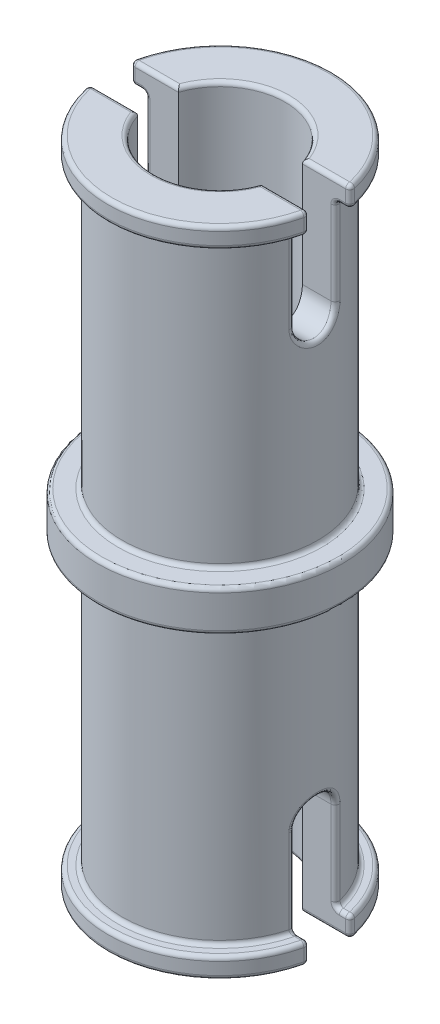
from build123d import *

# Parameters (mm, degrees)
CUT_EXTRUDE1_DEPTH      = 7.5
CUT_EXTRUDE2_DEPTH      = 10
CUT_EXTRUDE2_DEPTH_BACK = 10
FILLET3_R               = 0.8
FILLET4_R               = 0.1
SKETCH4_R               = 12.687072168
CUT_EXTRUDE3_DEPTH      = 10


with BuildPart() as part:
    # Sketch1 → Revolve1 (revolve)
    with BuildSketch(Plane(origin=(0, 0, 0), x_dir=(0, 0, -1), z_dir=(1, 0, 0))):
        Polygon((2.4, 0.5), (2.4, 7.5), (3, 7.5), (3, 8.5), (2.4, 8.5), (2.4, 16), (0, 16), (0, 7.5), (1.6, 7.5), (1.6, 0), (2.75, 0), (2.75, 0.5), align=None)
    revolve(axis=Axis((0, 0, 0), (0, 1, 0)))

    # Sketch2 → Cut-Extrude1 (cut)
    with BuildSketch(Plane(origin=(0, 16, 0), x_dir=(1, 0, 0), z_dir=(0, 1, 0))):
        with BuildLine():
            Line((0.9, -0.9), (2.224859546, -0.9))
            ThreePointArc((2.224859546, -0.9), (1.697056275, -1.697056275), (0.9, -2.224859546))
            Line((0.9, -2.224859546), (0.9, -0.9))
        make_face()
        with BuildLine():
            Line((-0.9, -0.9), (-0.9, -2.224859546))
            ThreePointArc((-0.9, -2.224859546), (-1.697056275, -1.697056275), (-2.224859546, -0.9))
            Line((-2.224859546, -0.9), (-0.9, -0.9))
        make_face()
        with BuildLine():
            Line((-0.9, 2.224859546), (-0.9, 0.9))
            Line((-0.9, 0.9), (-2.224859546, 0.9))
            ThreePointArc((-2.224859546, 0.9), (-1.697056275, 1.697056275), (-0.9, 2.224859546))
        make_face()
        with BuildLine():
            Line((0.9, 2.224859546), (0.9, 0.9))
            Line((0.9, 0.9), (2.224859546, 0.9))
            ThreePointArc((2.224859546, 0.9), (1.697056275, 1.697056275), (0.9, 2.224859546))
        make_face()
    extrude(amount=-CUT_EXTRUDE1_DEPTH, mode=Mode.SUBTRACT)

    # Sketch3 → Cut-Extrude2 (cut, two sides: drawn at the far end of the back side and taken through both)
    with BuildSketch(Plane(origin=(0, 0, 0), x_dir=(0, 0, -1), z_dir=(1, 0, 0)).offset(-CUT_EXTRUDE2_DEPTH_BACK)):
        with BuildLine():
            Line((0.5, 2.657804805), (0.5, 0))
            Line((0.5, 0), (-0.5, 0))
            Line((-0.5, 0), (-0.5, 2.657804805))
            ThreePointArc((-0.5, 2.657804805), (0, 3.157804805), (0.5, 2.657804805))
        make_face()
    extrude(amount=CUT_EXTRUDE2_DEPTH + CUT_EXTRUDE2_DEPTH_BACK, mode=Mode.SUBTRACT)

    # Fillet3
    fillet3_edges = [part.edges().sort_by_distance(p)[0] for p in [
        (2.4, 16, 0),
        (0.9, 16, -1.562429773),
        (1.562429773, 16, -0.9),
        (0, 16, -2.4),
        (-1.562429773, 16, -0.9),
        (-0.9, 16, -1.562429773),
        (0, 16, 2.4),
        (1.562429773, 16, 0.9),
        (0.9, 16, 1.562429773),
        (-2.4, 16, 0),
        (-0.9, 16, 1.562429773),
        (-1.562429773, 16, 0.9),
    ]]
    fillet(fillet3_edges, radius=FILLET3_R)

    # Fillet4
    fillet4_edges = [part.edges().sort_by_distance(p)[0] for p in [
        (0, 8.5, 3),
        (2.030615223, 15.804098792, 0.624466061),
        (2.030615223, 15.804098792, -0.624466061),
        (0.616839126, 15.810636813, 0.616839126),
        (0.616839126, 15.810636813, -0.616839126),
        (0.624466061, 15.804098792, 2.030615224),
        (0.624466061, 15.804098792, -2.030615223),
        (-0.624466061, 15.804098792, 2.030615223),
        (-0.624466061, 15.804098792, -2.030615223),
        (-0.616839126, 15.810636813, 0.616839126),
        (-0.616839126, 15.810636813, -0.616839126),
        (-2.030615224, 15.804098792, 0.624466061),
        (-2.030615223, 15.804098792, -0.624466061),
        (0, 7.5, 3),
        (2.4, 8.5, 0),
        (0.9, 11.85, -2.224859546),
        (1.562429773, 8.5, -0.9),
        (2.224859546, 11.85, -0.9),
        (0.9, 8.5, -1.562429773),
        (0.9, 11.85, -0.9),
        (0, 8.5, -2.4),
        (-2.224859546, 11.85, -0.9),
        (-0.9, 8.5, -1.562429773),
        (-0.9, 11.85, -2.224859546),
        (-1.562429773, 8.5, -0.9),
        (-0.9, 11.85, -0.9),
        (0, 8.5, 2.4),
        (2.224859546, 11.85, 0.9),
        (0.9, 8.5, 1.562429773),
        (0.9, 11.85, 2.224859546),
        (1.562429773, 8.5, 0.9),
        (0.9, 11.85, 0.9),
        (-2.4, 8.5, 0),
        (-0.9, 11.85, 2.224859546),
        (-1.562429773, 8.5, 0.9),
        (-2.224859546, 11.85, 0.9),
        (-0.9, 8.5, 1.562429773),
        (-0.9, 11.85, 0.9),
        (0, 0.5, 2.4),
        (1.509966887, 0.5, -1.865475811),
        (2.347338919, 1.578902402, -0.5),
        (2.4, 3.157804805, 0),
        (2.347338919, 1.578902402, 0.5),
        (-2.347338919, 1.578902402, -0.5),
        (-2.4, 3.157804805, 0),
        (-2.347338919, 1.578902402, 0.5),
        (0, 0.5, 2.75),
        (0, 0.5, -2.75),
        (0, 0, 2.75),
        (0, 0, -2.75),
        (0, 0, 1.6),
        (-0.938083152, 0, -1.29614814),
        (2.112015936, 0, 0.5),
        (0, 7.5, 2.4),
        (2.704163457, 0.25, 0.5),
        (2.525751188, 0.5, 0.5),
        (-2.112015936, 0, -0.5),
        (-2.704163457, 0.25, -0.5),
        (-2.525751188, 0.5, -0.5),
        (-2.525751188, 0.5, 0.5),
        (-2.704163457, 0.25, 0.5),
        (-2.112015936, 0, 0.5),
        (2.112015936, 0, -0.5),
        (2.525751188, 0.5, -0.5),
        (2.704163457, 0.25, -0.5),
    ]]
    fillet(fillet4_edges, radius=FILLET4_R)

    # Sketch4 → Cut-Extrude3 (cut)
    with BuildSketch(Plane(origin=(0, 8.5, 0), x_dir=(1, 0, 0), z_dir=(0, 1, 0))):
        Circle(SKETCH4_R)
    extrude(amount=CUT_EXTRUDE3_DEPTH, mode=Mode.SUBTRACT)

    # Mirror5: part across plane


with BuildPart() as part_1:
    add(part.part)
    add(part.part.mirror(Plane.ZX.offset(8)))


solid = part_1.part
